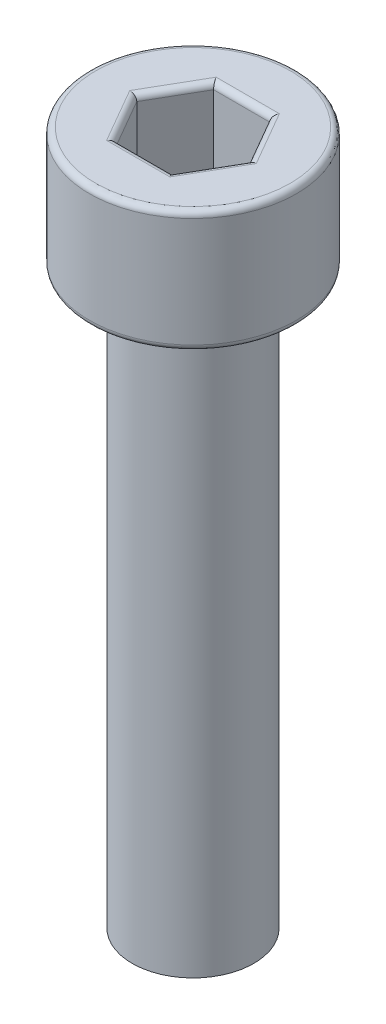
from build123d import *

# Parameters (mm, degrees)
CUT_EXTRUDE1_DEPTH = 3.5
FILLET1_R          = 0.25


with BuildPart() as part:
    # Sketch2 → Revolve1 (revolve)
    with BuildSketch(Plane.XY, mode=Mode.PRIVATE) as revolve1_sk:
        Polygon((0, 5), (4.25, 5), (4.25, 0), (2.5, 0), (2.5, -23.5), (0, -23.5), align=None)
    revolve(revolve1_sk.sketch.rotate(Axis((0, 21.322324325, 0), (0, -1, 0)), 180), axis=Axis((0, 21.322324325, 0), (0, -1, 0)))

    # Sketch3 → Cut-Extrude1 (cut)
    with BuildSketch(Plane(origin=(0, 5, 0), x_dir=(1, 0, 0), z_dir=(0, 1, 0))):
        Polygon((2.309401077, 0), (1.154700538, 2), (-1.154700538, 2), (-2.309401077, 0), (-1.154700538, -2), (1.154700538, -2), align=None)
    extrude(amount=-CUT_EXTRUDE1_DEPTH, mode=Mode.SUBTRACT)

    # Fillet1
    fillet1_edges = [part.edges().sort_by_distance(p)[0] for p in [
        (1.732050808, 5, 1),
        (1.732050808, 5, -1),
        (0, 5, -2),
        (-1.732050808, 5, -1),
        (-1.732050808, 5, 1),
        (0, 5, 2),
        (2.5, 0, 0),
        (4.25, 0, 0),
        (4.25, 5, 0),
    ]]
    fillet(fillet1_edges, radius=FILLET1_R)


solid = part.part
